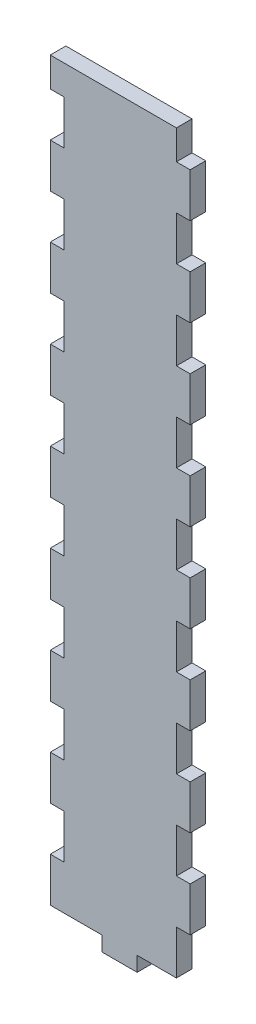
from build123d import *

# Parameters (mm, degrees)
BOSS_EXTRUDE1_DEPTH = 3.18
SKETCH2_W           = 2.8
SKETCH2_H           = 9
SKETCH2_H_2         = 6
CUT_EXTRUDE1_DEPTH  = 153.716608134


with BuildPart() as part:
    # Sketch1 → Boss-Extrude1 (new body)
    with BuildSketch(Plane.XY):
        Polygon((-10.795, 0), (-10.795, -3), (-17.915, -3), (-17.915, 0), (-28.5, 0), (-28.5, 150), (0, 150), (0, 0), align=None)
    extrude(amount=BOSS_EXTRUDE1_DEPTH)

    # Sketch2 → Cut-Extrude1 (cut, through all)
    with BuildSketch(Plane.XY.offset(3.18)):
        with Locations((-27.1, 13.5)):
            Rectangle(SKETCH2_W, SKETCH2_H)
        with Locations((-27.1, 31.5)):
            Rectangle(SKETCH2_W, SKETCH2_H)
        with Locations((-27.1, 49.5)):
            Rectangle(SKETCH2_W, SKETCH2_H)
        with Locations((-27.1, 67.5)):
            Rectangle(SKETCH2_W, SKETCH2_H)
        with Locations((-27.1, 85.5)):
            Rectangle(SKETCH2_W, SKETCH2_H)
        with Locations((-27.1, 103.5)):
            Rectangle(SKETCH2_W, SKETCH2_H)
        with Locations((-27.1, 121.5)):
            Rectangle(SKETCH2_W, SKETCH2_H)
        with Locations((-27.1, 139.5)):
            Rectangle(SKETCH2_W, SKETCH2_H)
        with Locations((-1.4, 4.5)):
            Rectangle(SKETCH2_W, SKETCH2_H)
        with Locations((-1.4, 22.5)):
            Rectangle(SKETCH2_W, SKETCH2_H)
        with Locations((-1.4, 40.5)):
            Rectangle(SKETCH2_W, SKETCH2_H)
        with Locations((-1.4, 58.5)):
            Rectangle(SKETCH2_W, SKETCH2_H)
        with Locations((-1.4, 76.5)):
            Rectangle(SKETCH2_W, SKETCH2_H)
        with Locations((-1.4, 94.5)):
            Rectangle(SKETCH2_W, SKETCH2_H)
        with Locations((-1.4, 112.5)):
            Rectangle(SKETCH2_W, SKETCH2_H)
        with Locations((-1.4, 130.5)):
            Rectangle(SKETCH2_W, SKETCH2_H)
        with Locations((-1.4, 147)):
            Rectangle(SKETCH2_W, SKETCH2_H_2)
    extrude(amount=-CUT_EXTRUDE1_DEPTH, mode=Mode.SUBTRACT)


solid = part.part
